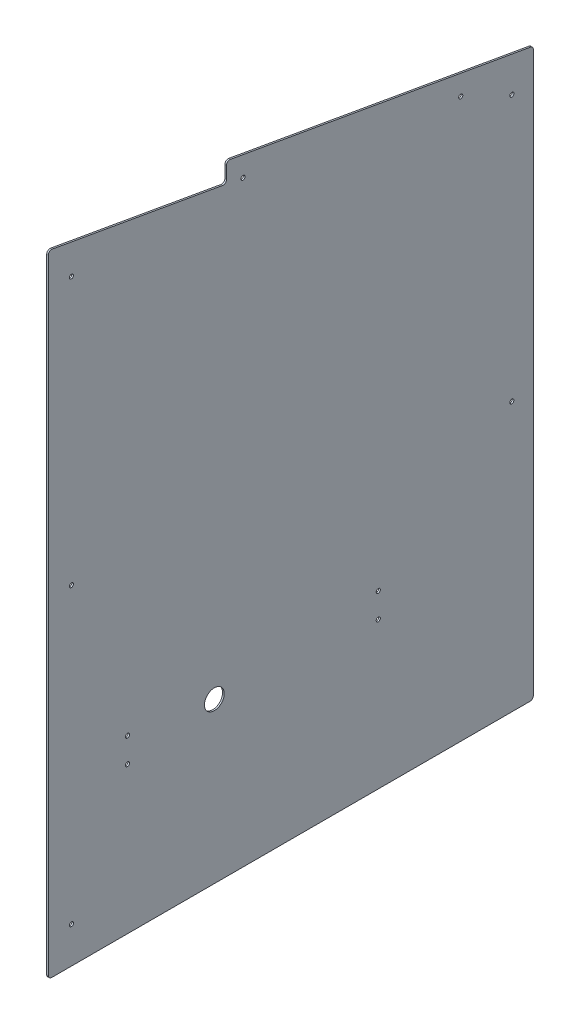
from build123d import *

# Parameters (mm, degrees)
BOSS_EXTRUDE1_DEPTH            = 3.175
SKETCH2_R                      = 19.05
CUT_EXTRUDE1_DEPTH             = 1533.120451208
FILLET1_R                      = 6.35
F_5_16_0_3125_DIAMETER_HOLE1_D = 7.9375


with BuildPart() as part:
    # Sketch1 → Boss-Extrude1 (new body)
    with BuildSketch(Plane(origin=(0, 0, 0), x_dir=(0, 0, -1), z_dir=(1, 0, 0))):
        Polygon((0, 0), (933.45, 0), (933.45, 1089.025), (342.9, 1193.154898457), (342.9, 1154.467144545), (0, 1214.929666229), align=None)
    extrude(amount=BOSS_EXTRUDE1_DEPTH)

    # Sketch2 → Cut-Extrude1 (cut, through all)
    with BuildSketch(Plane(origin=(3.175, 0, 0), x_dir=(0, 0, -1), z_dir=(1, 0, 0))):
        with Locations((319.532, 307.34)):
            Circle(SKETCH2_R)
    extrude(amount=-CUT_EXTRUDE1_DEPTH, mode=Mode.SUBTRACT)

    # Fillet1
    fillet1_edges = [part.edges().sort_by_distance(p)[0] for p in [
        (1.5875, 1214.929666229, 0),
        (1.5875, 1154.467144545, -342.9),
        (1.5875, 1193.154898457, -342.9),
        (1.5875, 1089.025, -933.45),
        (1.5875, 0, -933.45),
        (1.5875, 0, 0),
    ]]
    fillet(fillet1_edges, radius=FILLET1_R)

    # 5/16 (0.3125) Diameter Hole1 (through all)
    with Locations(Plane(origin=(3.175, 0, 0), x_dir=(0, 0, -1), z_dir=(1, 0, 0))):
        with Locations((44.45, 1149.35), (44.45, 635), (152.4, 330.2), (152.4, 282.575), (635, 330.2), (635, 282.575), (892.175, 517.525), (892.175, 1028.7), (374.65, 1148.868762907), (793.75, 1074.970125292), (44.45, 69.85)):
            Hole(F_5_16_0_3125_DIAMETER_HOLE1_D / 2)


solid = part.part
